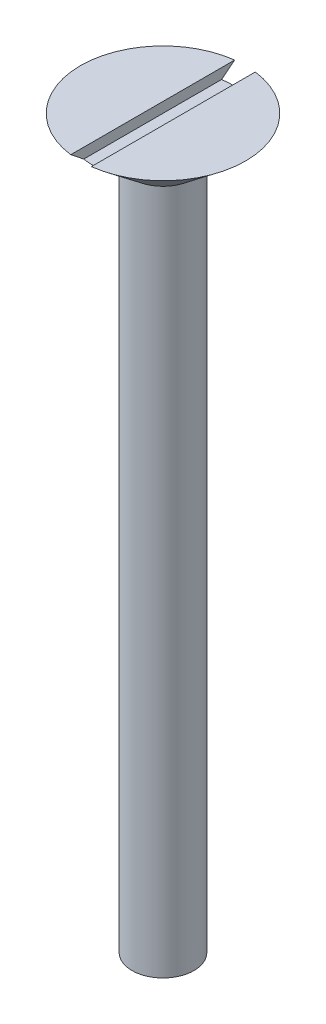
from build123d import *

# Parameters (mm, degrees)
SKETCH7_W           = 1
SKETCH7_H           = 8.308245604
CUT_EXTRUDE3_DEPTH  = 0.5
SKETCH8_R           = 1.5
BOSS_EXTRUDE3_DEPTH = 33.2


with BuildPart() as part:
    # Sketch6 → Revolve1 (revolve)
    with BuildSketch(Plane.XY, mode=Mode.PRIVATE) as revolve1_sk:
        Polygon((0, 0), (4, 0), (1.5, -2), (0, -2), align=None)
    revolve(revolve1_sk.sketch.rotate(Axis((0, 0, 0), (0, 1, 0)), 90), axis=Axis((0, 0, 0), (0, 1, 0)))

    # Sketch7 → Cut-Extrude3 (cut)
    with BuildSketch(Plane(origin=(0, 0, 0), x_dir=(1, 0, 0), z_dir=(0, 1, 0))):
        Rectangle(SKETCH7_W, SKETCH7_H)
    extrude(amount=-CUT_EXTRUDE3_DEPTH, mode=Mode.SUBTRACT)

    # Sketch8 → Boss-Extrude3 (add)
    with BuildSketch(Plane.XZ.offset(2)):
        with Locations(Location((0, 0, 0), (0, 0, 90))):
            Circle(SKETCH8_R)
    extrude(amount=BOSS_EXTRUDE3_DEPTH)


solid = part.part
